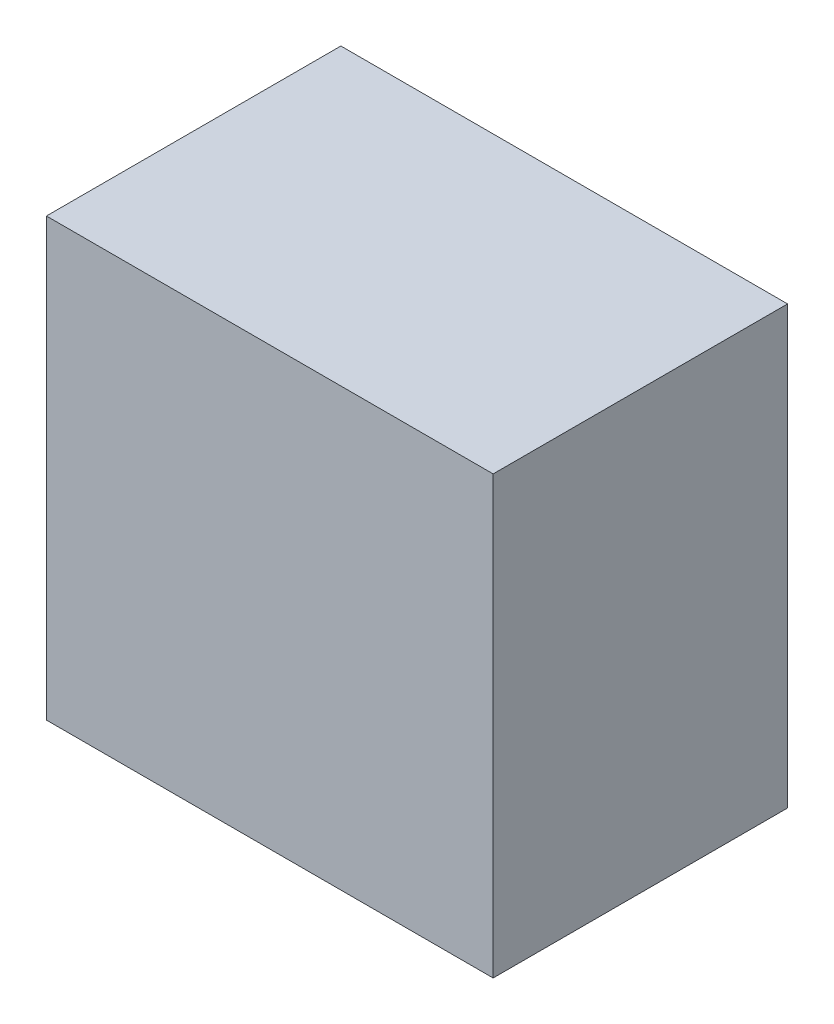
from build123d import *

# Parameters (mm, degrees)
SKETCH1_W           = 88
SKETCH1_H           = 86
BOSS_EXTRUDE1_DEPTH = 58


with BuildPart() as part:
    # Sketch1 → Boss-Extrude1 (new body)
    with BuildSketch(Plane.XY):
        with Locations((44, 43)):
            Rectangle(SKETCH1_W, SKETCH1_H)
    extrude(amount=-BOSS_EXTRUDE1_DEPTH)


solid = part.part
